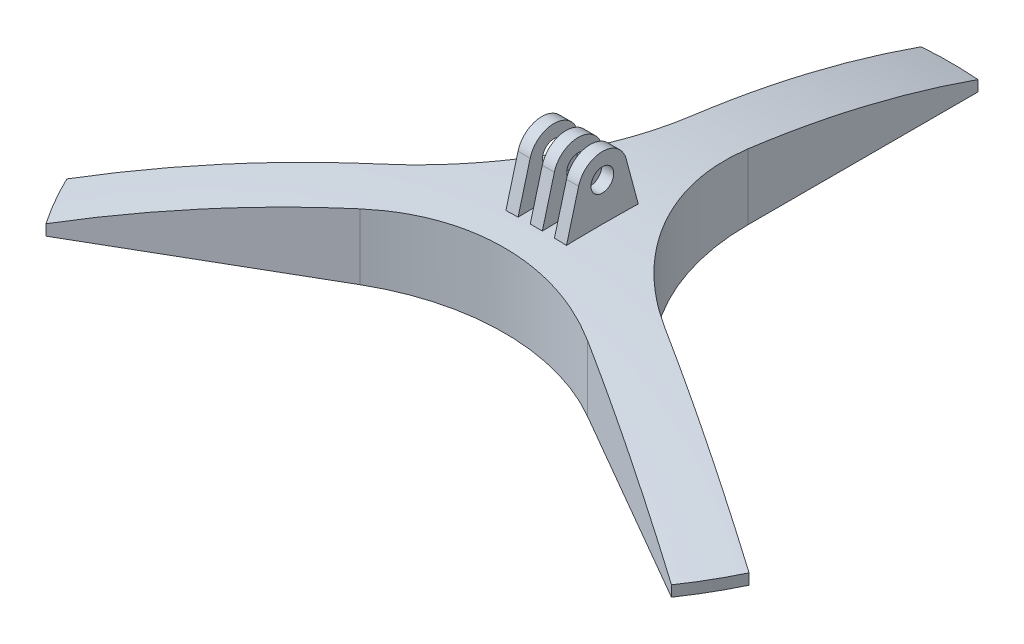
from build123d import *

# Parameters (mm, degrees)
BOSS_EXTRUDE1_DEPTH = 20
BOSS_EXTRUDE2_DEPTH = 1.6
SKETCH5_R           = 3
CUT_EXTRUDE1_DEPTH  = 145.767236586
SKETCH6_R           = 5.25
CUT_EXTRUDE2_DEPTH  = 2


with BuildPart() as part:
    # Sketch1 → Boss-Extrude1 (new body)
    with BuildSketch(Plane(origin=(0, 0, 0), x_dir=(1, 0, 0), z_dir=(0, 1, 0))):
        with BuildLine():
            Line((-7.5, 99.718353376), (-7.5, 38.97114317))
            ThreePointArc((-7.5, 38.97114317), (-15.538475773, 8.97114317), (-37.5, -12.990381057))
            Line((-37.5, -12.990381057), (-90.108627247, -43.36398616))
            ThreePointArc((-90.108627247, -43.36398616), (-86.602540378, -50), (-82.608627247, -56.354367216))
            Line((-82.608627247, -56.354367216), (-30, -25.980762114))
            ThreePointArc((-30, -25.980762114), (0, -17.942286341), (30, -25.980762114))
            Line((30, -25.980762114), (82.608627247, -56.354367216))
            ThreePointArc((82.608627247, -56.354367216), (86.602540035, -50.000000595), (90.108626651, -43.363987398))
            Line((90.108626651, -43.363987398), (37.5, -12.99038264))
            ThreePointArc((37.5, -12.99038264), (15.538475773, 8.971141587), (7.5, 38.971141587))
            Line((7.5, 38.971141587), (7.5, 99.718353376))
            ThreePointArc((7.5, 99.718353376), (0, 100), (-7.5, 99.718353376))
        make_face()
    extrude(amount=BOSS_EXTRUDE1_DEPTH)

    # Sketch2 → Cut-Revolve4 (revolve, cut)
    with BuildSketch(Plane.XY):
        with BuildLine():
            Line((0, 20), (0, 34.954541697))
            Line((0, 34.954541697), (120, 34.954541697))
            Line((120, 34.954541697), (120, -5.045458303))
            ThreePointArc((120, -5.045458303), (61.292893107, 13.671893879), (0, 20))
        make_face()
    revolve(axis=Axis((0, 0, 0), (0, 1, 0)), mode=Mode.SUBTRACT)


with BuildPart() as body_2:
    # Sketch4 → Boss-Extrude2 (new, symmetric)
    with BuildSketch(Plane(origin=(0, 0, 0), x_dir=(0, 0, -1), z_dir=(1, 0, 0))):
        with BuildLine():
            Line((-6.278517871, 31.682323793), (-9.933210146, 18.042826538))
            add(Edge.make_bspline(
                [(9.55294178, 19.4620074), (9.366408214, 19.462627062), (6.910672995, 19.466883672), (4.548636298, 19.419395978), (1.398759391, 19.284530963), (0.380021767, 19.228451245), (-1.591242497, 19.094905023), (-2.544701819, 19.017397796), (-5.310174504, 18.753138299), (-7.02767955, 18.53478756), (-9.066841454, 18.200216125), (-9.505139098, 18.123246137), (-9.933210146, 18.042826538)],
                knots=[0.489756792, 0.489756792, 0.489756792, 0.489756792, 0.5, 0.625, 0.625, 0.6875, 0.6875, 0.75, 0.75, 0.875, 0.875, 0.910234617, 0.910234617, 0.910234617, 0.910234617], degree=3))
            Line((9.55294178, 19.4620074), (6.278517871, 31.682323793))
            ThreePointArc((6.278517871, 31.682323793), (0, 36.5), (-6.278517871, 31.682323793))
        make_face()
    extrude(amount=BOSS_EXTRUDE2_DEPTH, both=True)


with BuildPart() as body_3:
    # Body-Move/Copy2: copy of body 2
    add(body_2.part.moved(Location((6.4, 0, 0))))


with BuildPart() as body_4:
    # Body-Move/Copy3: copy of body 2
    add(body_2.part.moved(Location((-6.4, 0, 0))))


with BuildPart() as cut_extrude1_tool:
    # Sketch5 → Cut-Extrude1 (new, through all)
    with BuildSketch(Plane(origin=(8, 0, 0), x_dir=(0, 0, -1), z_dir=(1, 0, 0))):
        with Locations((0, 30)):
            Circle(SKETCH5_R)
    extrude(amount=-CUT_EXTRUDE1_DEPTH)


with BuildPart() as body_2_1:
    add(body_2.part)

    # Cut-Extrude1: cut by cut_extrude1_tool
    add(cut_extrude1_tool.part, mode=Mode.SUBTRACT)


with BuildPart() as body_3_1:
    add(body_3.part)

    # Cut-Extrude1: cut by cut_extrude1_tool
    add(cut_extrude1_tool.part, mode=Mode.SUBTRACT)


with BuildPart() as body_4_1:
    add(body_4.part)

    # Cut-Extrude1: cut by cut_extrude1_tool
    add(cut_extrude1_tool.part, mode=Mode.SUBTRACT)

    # Sketch6 → Cut-Extrude2 (cut)
    with BuildSketch(Plane.ZY.offset(8)):
        with Locations((0, 30)):
            Circle(SKETCH6_R)
    extrude(amount=-CUT_EXTRUDE2_DEPTH, mode=Mode.SUBTRACT)


solid = Compound([part.part, body_2_1.part, body_3_1.part, body_4_1.part])
